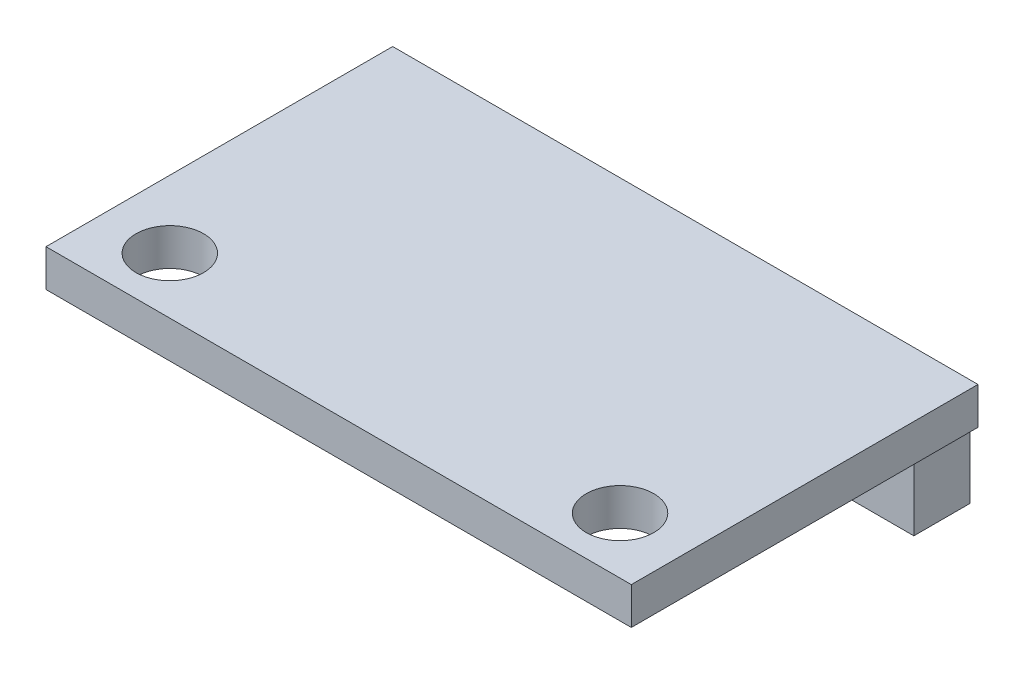
from build123d import *

# Parameters (mm, degrees)
SKETCH1_W           = 26
SKETCH1_H           = 15.4
SKETCH1_R           = 1.5
BOSS_EXTRUDE1_DEPTH = 1.65
SKETCH2_W           = 25.5
SKETCH2_H           = 2.5
BOSS_EXTRUDE2_DEPTH = 3


with BuildPart() as part:
    # Sketch1 → Boss-Extrude1 (new body)
    with BuildSketch(Plane(origin=(0, 0, 0), x_dir=(1, 0, 0), z_dir=(0, 1, 0))):
        Rectangle(SKETCH1_W, SKETCH1_H)
        with Locations(Location((-10, -5.2, 0), (0, 0, 270))):
            Circle(SKETCH1_R, mode=Mode.SUBTRACT)
        with Locations(Location((10, -5.2, 0), (0, 0, 270))):
            Circle(SKETCH1_R, mode=Mode.SUBTRACT)
    extrude(amount=BOSS_EXTRUDE1_DEPTH)

    # Sketch2 → Boss-Extrude2 (add)
    with BuildSketch(Plane.XZ):
        with Locations((0, -6.35)):
            Rectangle(SKETCH2_W, SKETCH2_H)
    extrude(amount=BOSS_EXTRUDE2_DEPTH)


solid = part.part
